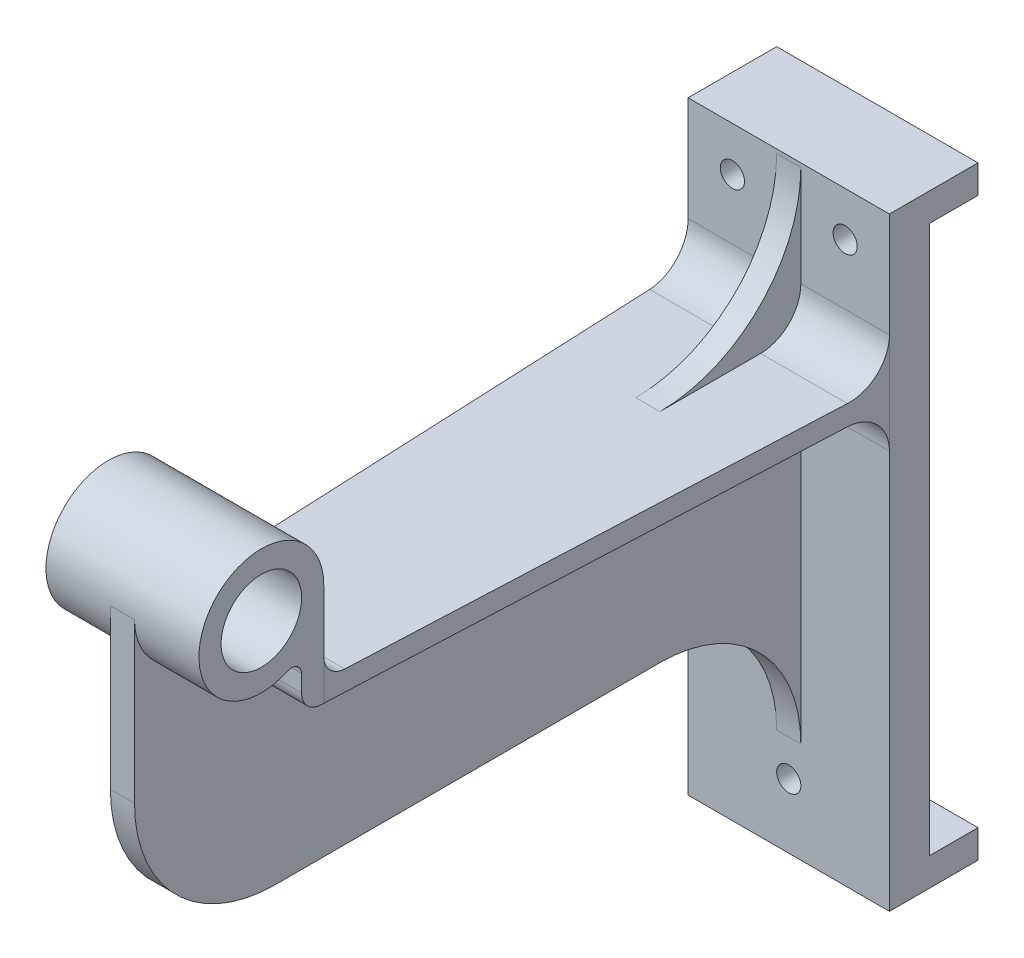
from build123d import *

# Parameters (mm, degrees)
BOSS_EXTRUDE1_DEPTH = 100
SKETCH4_R           = 20
BOSS_EXTRUDE3_DEPTH = 38
BOSS_EXTRUDE4_DEPTH = 10
FILLET1_R           = 10
FILLET2_R           = 5
BOSS_EXTRUDE5_DEPTH = 6
FILLET3_R           = 20
BOSS_EXTRUDE6_DEPTH = 6
HOLE1_D             = 12
HOLE1_DEPTH         = 44


with BuildPart() as part:
    # Sketch1 → Boss-Extrude1 (new body)
    with BuildSketch(Plane(origin=(0, 0, 0), x_dir=(0, 0, -1), z_dir=(1, 0, 0))):
        Polygon((20, -136), (44, -136), (44, -150), (0, -150), (0, 150), (44, 150), (44, 136), (20, 136), align=None)
    extrude(amount=BOSS_EXTRUDE1_DEPTH)



with BuildPart() as body_2:
    # Sketch4 → Boss-Extrude3 (new, symmetric)
    with BuildSketch(Plane(origin=(50, 0, 0), x_dir=(0, 0, -1), z_dir=(1, 0, 0))):
        with BuildLine():
            Line((-269, 119), (-269, 68))
            Line((-269, 68), (-280, 68))
            Line((-280, 68), (-280, 95.314561435))
            ThreePointArc((-280, 95.314561435), (-328.115831839, 132.057564857), (-269, 119))
        make_face()
        with Locations((-300, 119)):
            Circle(SKETCH4_R, mode=Mode.SUBTRACT)
    extrude(amount=BOSS_EXTRUDE3_DEPTH, both=True)


with BuildPart() as part_1:
    add(part.part)

    add(body_2.part)  # Boss-Extrude4 merges body 2
    # Sketch7 → Boss-Extrude4 (add)
    with BuildSketch(Plane.XZ.offset(-68)):
        Polygon((88, 280), (12, 280), (12, 269), (0, 0), (0, -5), (100, -5), (100, 0), (88, 269), align=None)
    extrude(amount=-BOSS_EXTRUDE4_DEPTH)

    # Fillet1
    fillet1_edges = [part_1.edges().sort_by_distance(p)[0] for p in [
        (50, 68, 280),
        (50, 78, 269),
    ]]
    fillet(fillet1_edges, radius=FILLET1_R)

    # Fillet2
    fillet2_edges = [part_1.edges().sort_by_distance(p)[0] for p in [
        (50, 95.314561435, 280),
    ]]
    fillet(fillet2_edges, radius=FILLET2_R)

    # Sketch8 → Boss-Extrude5 (add, symmetric)
    with BuildSketch(Plane(origin=(50, 0, 0), x_dir=(0, 0, -1), z_dir=(1, 0, 0))):
        with BuildLine():
            Line((0, 78), (-70, 78))
            ThreePointArc((-70, 78), (-20.502525317, 98.502525317), (0, 148))
            Line((0, 148), (0, 78))
        make_face()
    extrude(amount=BOSS_EXTRUDE5_DEPTH, both=True)

    # Fillet3
    fillet3_edges = [part_1.edges().sort_by_distance(p)[0] for p in [
        (78, 78, 0),
        (50, 68, 0),
        (22, 78, 0),
    ]]
    fillet(fillet3_edges, radius=FILLET3_R)

    # Sketch10 → Boss-Extrude6 (add, symmetric)
    with BuildSketch(Plane(origin=(50, 0, 0), x_dir=(0, 0, -1), z_dir=(1, 0, 0))):
        with BuildLine():
            Line((-331, 119), (-331, 40))
            ThreePointArc((-331, 40), (-310.497474683, -9.497474683), (-261, -30))
            Line((-261, -30), (-70, -30))
            ThreePointArc((-70, -30), (-20.502525317, -50.502525317), (0, -100))
            Line((0, -100), (0, 48))
            ThreePointArc((0, 48), (-5.857864376, 62.142135624), (-20, 68))
            Line((-20, 68), (-269, 68))
            Line((-269, 68), (-270, 68))
            ThreePointArc((-270, 68), (-277.071067812, 70.928932188), (-280, 78))
            Line((-280, 78), (-280, 86.273863656))
            ThreePointArc((-280, 86.273863656), (-282.299691376, 90.481990714), (-287.083333333, 90.819160371))
            ThreePointArc((-287.083333333, 90.819160371), (-316.741913471, 92.909612243), (-331, 119))
        make_face()
    extrude(amount=BOSS_EXTRUDE6_DEPTH, both=True)

    # Hole1
    with Locations(Plane.XY):
        with Locations((50, -118), (22, 128), (78, 128)):
            Hole(HOLE1_D / 2, depth=HOLE1_DEPTH)


solid = part_1.part
